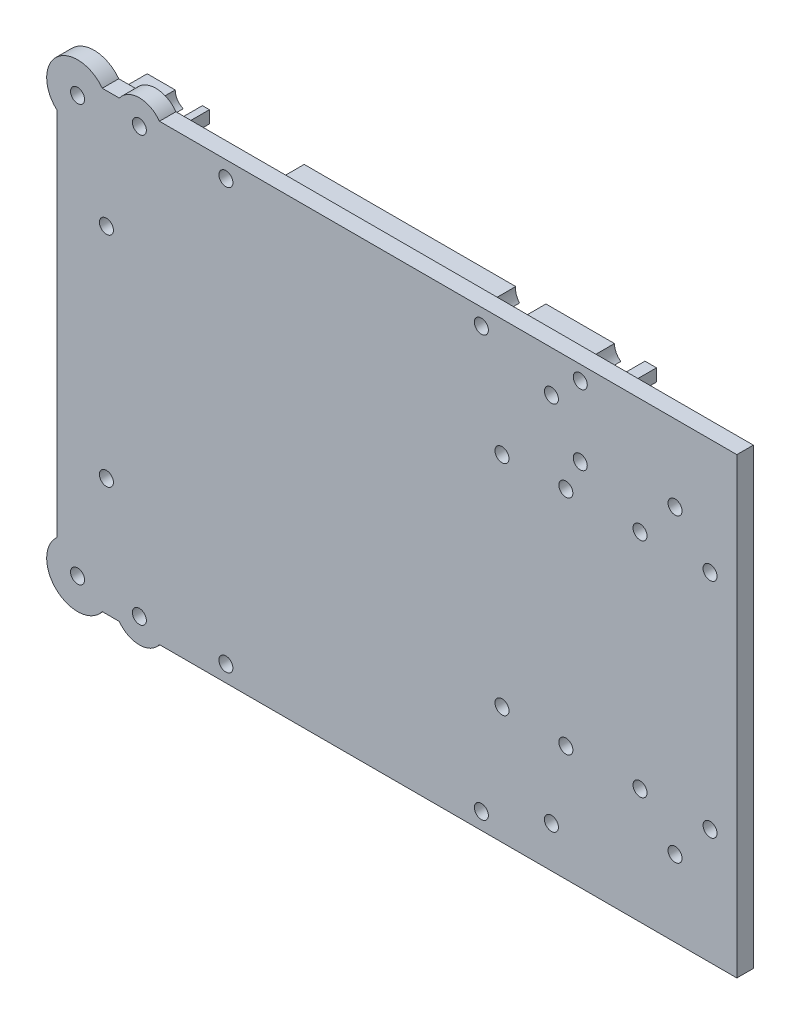
from build123d import *

# Parameters (mm, degrees)
MAIN_PROFILE_SKETCH_R    = 1.7
MAIN_EXTRUSION_DEPTH     = 4
DETAIL_EXTRUSION_2_DEPTH = 8


with BuildPart() as part:
    # Main Profile Sketch → Main Extrusion (new body)
    with BuildSketch(Plane.XY.offset(48.5)):
        with BuildLine():
            Line((-110, 55), (-110, -55))
            Line((-110, -55), (-250.126602828, -55))
            ThreePointArc((-250.126602828, -55), (-255, -57.5), (-259.873397172, -55))
            Line((-259.873397172, -55), (-264, -55))
            ThreePointArc((-264, -55), (-275.069801019, -56.026944692), (-275, -44.909830056))
            Line((-275, -44.909830056), (-275, 44.909830056))
            ThreePointArc((-275, 44.909830056), (-275.069801019, 56.026944692), (-264, 55))
            Line((-264, 55), (-259.873397172, 55))
            ThreePointArc((-259.873397172, 55), (-255, 57.5), (-250.126602828, 55))
            Line((-250.126602828, 55), (-110, 55))
        make_face()
        with Locations((-270, -50.5)):
            Circle(MAIN_PROFILE_SKETCH_R, mode=Mode.SUBTRACT)
        with Locations((-255, -51.5)):
            Circle(MAIN_PROFILE_SKETCH_R, mode=Mode.SUBTRACT)
        with Locations((-234, -51)):
            Circle(MAIN_PROFILE_SKETCH_R, mode=Mode.SUBTRACT)
        with Locations((-263, -26.5)):
            Circle(MAIN_PROFILE_SKETCH_R, mode=Mode.SUBTRACT)
        with Locations((-172, -51)):
            Circle(MAIN_PROFILE_SKETCH_R, mode=Mode.SUBTRACT)
        with Locations((-155, -45)):
            Circle(MAIN_PROFILE_SKETCH_R, mode=Mode.SUBTRACT)
        with Locations((-125, -36.5)):
            Circle(MAIN_PROFILE_SKETCH_R, mode=Mode.SUBTRACT)
        with Locations((-167, -26.5)):
            Circle(MAIN_PROFILE_SKETCH_R, mode=Mode.SUBTRACT)
        with Locations((-151.5, -27)):
            Circle(MAIN_PROFILE_SKETCH_R, mode=Mode.SUBTRACT)
        with Locations((-133.5, -27)):
            Circle(MAIN_PROFILE_SKETCH_R, mode=Mode.SUBTRACT)
        with Locations((-116.5, -27)):
            Circle(MAIN_PROFILE_SKETCH_R, mode=Mode.SUBTRACT)
        with Locations((-263, 26.5)):
            Circle(MAIN_PROFILE_SKETCH_R, mode=Mode.SUBTRACT)
        with Locations((-270, 50.5)):
            Circle(MAIN_PROFILE_SKETCH_R, mode=Mode.SUBTRACT)
        with Locations((-255, 51.5)):
            Circle(MAIN_PROFILE_SKETCH_R, mode=Mode.SUBTRACT)
        with Locations((-234, 51)):
            Circle(MAIN_PROFILE_SKETCH_R, mode=Mode.SUBTRACT)
        with Locations((-167, 26.5)):
            Circle(MAIN_PROFILE_SKETCH_R, mode=Mode.SUBTRACT)
        with Locations((-151.5, 27)):
            Circle(MAIN_PROFILE_SKETCH_R, mode=Mode.SUBTRACT)
        with Locations((-133.5, 27)):
            Circle(MAIN_PROFILE_SKETCH_R, mode=Mode.SUBTRACT)
        with Locations((-116.5, 27)):
            Circle(MAIN_PROFILE_SKETCH_R, mode=Mode.SUBTRACT)
        with Locations((-155, 45)):
            Circle(MAIN_PROFILE_SKETCH_R, mode=Mode.SUBTRACT)
        with Locations((-172, 51)):
            Circle(MAIN_PROFILE_SKETCH_R, mode=Mode.SUBTRACT)
        with Locations((-148, 34.5)):
            Circle(MAIN_PROFILE_SKETCH_R, mode=Mode.SUBTRACT)
        with Locations((-125, 36.5)):
            Circle(MAIN_PROFILE_SKETCH_R, mode=Mode.SUBTRACT)
        with Locations((-148, 51.5)):
            Circle(MAIN_PROFILE_SKETCH_R, mode=Mode.SUBTRACT)
    extrude(amount=-MAIN_EXTRUSION_DEPTH)

    # Detail Profile 2 Sketch → Detail Extrusion 2 (add)
    with BuildSketch(Plane.XY.offset(44.5)):
        with BuildLine():
            Line((-265.417424305, -48.5), (-256.374772708, -48.5))
            ThreePointArc((-256.374772708, -48.5), (-257.777296342, -49.717691096), (-258.3, -51.5))
            Line((-258.3, -51.5), (-265.101020514, -51.5))
            ThreePointArc((-265.101020514, -51.5), (-265.027578843, -49.975569032), (-265.417424305, -48.5))
        make_face()
        with BuildLine():
            Line((-253.625227292, -48.5), (-250, -48.5))
            Line((-250, -48.5), (-250, -51.5))
            Line((-250, -51.5), (-251.7, -51.5))
            ThreePointArc((-251.7, -51.5), (-252.222703658, -49.717691096), (-253.625227292, -48.5))
        make_face()
        with BuildLine():
            Line((-227, -51.5), (-175.666060556, -51.5))
            ThreePointArc((-175.666060556, -51.5), (-175.531266062, -49.895391471), (-174.727636339, -48.5))
            Line((-174.727636339, -48.5), (-227, -48.5))
            Line((-227, -48.5), (-227, -51.5))
        make_face()
        with BuildLine():
            Line((-141.5, -48.5), (-141.5, -51.5))
            Line((-141.5, -51.5), (-168.333939444, -51.5))
            ThreePointArc((-168.333939444, -51.5), (-168.468733938, -49.895391471), (-169.272363661, -48.5))
            Line((-169.272363661, -48.5), (-141.5, -48.5))
        make_face()
        with BuildLine():
            Line((-265.101020514, 51.5), (-258.3, 51.5))
            ThreePointArc((-258.3, 51.5), (-257.777296342, 49.717691096), (-256.374772708, 48.5))
            Line((-256.374772708, 48.5), (-265.417424305, 48.5))
            ThreePointArc((-265.417424305, 48.5), (-265.027578843, 49.975569032), (-265.101020514, 51.5))
        make_face()
        with BuildLine():
            Line((-251.7, 51.5), (-250, 51.5))
            Line((-250, 51.5), (-250, 48.5))
            Line((-250, 48.5), (-253.625227292, 48.5))
            ThreePointArc((-253.625227292, 48.5), (-252.222703658, 49.717691096), (-251.7, 51.5))
        make_face()
        with BuildLine():
            Line((-227, 48.5), (-174.727636339, 48.5))
            ThreePointArc((-174.727636339, 48.5), (-175.531266062, 49.895391471), (-175.666060556, 51.5))
            Line((-175.666060556, 51.5), (-227, 51.5))
            Line((-227, 51.5), (-227, 48.5))
        make_face()
        with BuildLine():
            Line((-169.272363661, 48.5), (-150.165640783, 48.5))
            ThreePointArc((-150.165640783, 48.5), (-151.294151704, 49.81519599), (-151.7, 51.5))
            Line((-151.7, 51.5), (-168.333939444, 51.5))
            ThreePointArc((-168.333939444, 51.5), (-168.468733938, 49.895391471), (-169.272363661, 48.5))
        make_face()
        with BuildLine():
            Line((-141.5, 51.5), (-141.5, 48.5))
            Line((-141.5, 48.5), (-145.834359217, 48.5))
            ThreePointArc((-145.834359217, 48.5), (-144.705848296, 49.81519599), (-144.3, 51.5))
            Line((-144.3, 51.5), (-141.5, 51.5))
        make_face()
    extrude(amount=-DETAIL_EXTRUSION_2_DEPTH)


solid = part.part
